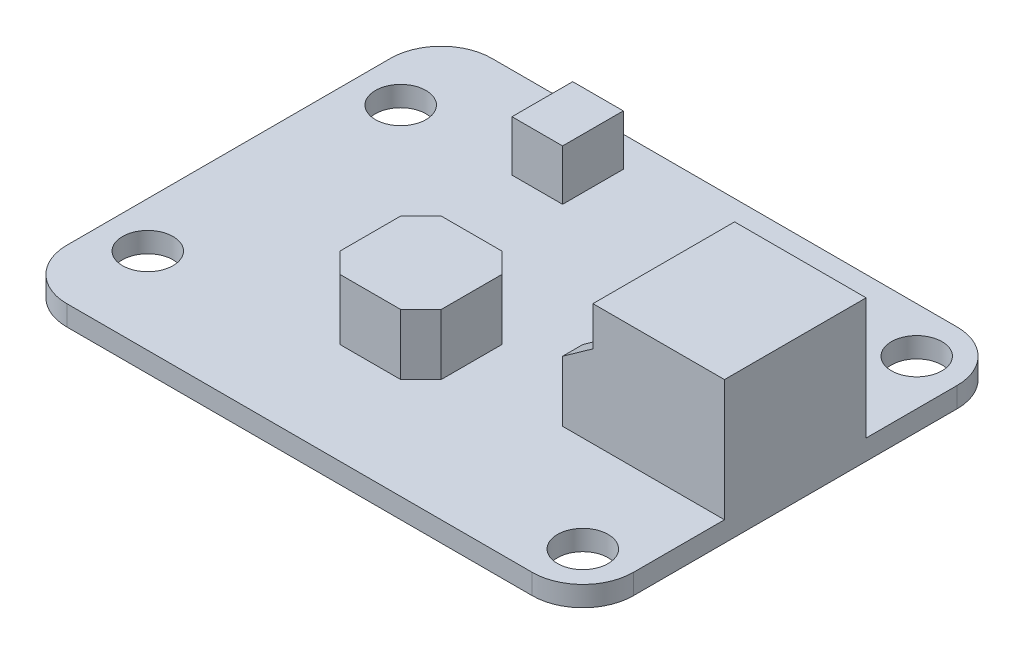
from build123d import *

# Parameters (mm, degrees)
CROQUIS1_R              = 1.25
SALIENTE_EXTRUIR1_DEPTH = 1
SALIENTE_EXTRUIR2_DEPTH = 6
CORTAR_EXTRUIR1_DEPTH   = 22
SALIENTE_EXTRUIR3_DEPTH = 3
CROQUIS5_W              = 2.5
CROQUIS5_H              = 3
SALIENTE_EXTRUIR4_DEPTH = 2.5


with BuildPart() as part:
    # Croquis1 → Saliente-Extruir1 (new body)
    with BuildSketch(Plane(origin=(0, 0, 0), x_dir=(1, 0, 0), z_dir=(0, 1, 0))):
        with BuildLine():
            Line((-11.5, -10.5), (11.5, -10.5))
            ThreePointArc((11.5, -10.5), (13.267766953, -9.767766953), (14, -8))
            Line((14, -8), (14, 8))
            ThreePointArc((14, 8), (13.267766953, 9.767766953), (11.5, 10.5))
            Line((11.5, 10.5), (-11.5, 10.5))
            ThreePointArc((-11.5, 10.5), (-13.267766953, 9.767766953), (-14, 8))
            Line((-14, 8), (-14, -8))
            ThreePointArc((-14, -8), (-13.267766953, -9.767766953), (-11.5, -10.5))
        make_face()
        with Locations(Location((11.75, -8.25, 0), (0, 0, 270))):
            Circle(CROQUIS1_R, mode=Mode.SUBTRACT)
        with Locations(Location((11.75, 8.25, 0), (0, 0, 270))):
            Circle(CROQUIS1_R, mode=Mode.SUBTRACT)
        with Locations(Location((-11.75, 6.25, 0), (0, 0, 270))):
            Circle(CROQUIS1_R, mode=Mode.SUBTRACT)
        with Locations(Location((-11.75, -6.25, 0), (0, 0, 270))):
            Circle(CROQUIS1_R, mode=Mode.SUBTRACT)
    extrude(amount=SALIENTE_EXTRUIR1_DEPTH)

    # Croquis2 → Saliente-Extruir2 (add)
    with BuildSketch(Plane(origin=(0, 1, 0), x_dir=(1, 0, 0), z_dir=(0, 1, 0))):
        Polygon((14, -3.5), (6, -3.5), (6, -2.5), (7.5, -2.5), (7.5, 2.5), (6, 2.5), (6, 3.5), (14, 3.5), align=None)
    extrude(amount=SALIENTE_EXTRUIR2_DEPTH)

    # Croquis3 → Cortar-Extruir1 (cut, through all)
    with BuildSketch(Plane.XY.offset(3.5)):
        Polygon((7.5, 7), (7.5, 5.064017175), (6, 4), (6, 7), align=None)
    extrude(amount=-CORTAR_EXTRUIR1_DEPTH, mode=Mode.SUBTRACT)

    # Croquis4 → Saliente-Extruir3 (add)
    with BuildSketch(Plane(origin=(0, 1, 0), x_dir=(1, 0, 0), z_dir=(0, 1, 0))):
        Polygon((-3, -5.5), (0, -5.5), (1, -4.5), (1, -1.5), (0, -0.5), (-3, -0.5), (-4, -1.5), (-4, -4.5), align=None)
    extrude(amount=SALIENTE_EXTRUIR3_DEPTH)

    # Croquis5 → Saliente-Extruir4 (add)
    with BuildSketch(Plane(origin=(0, 1, 0), x_dir=(1, 0, 0), z_dir=(0, 1, 0))):
        with Locations((-4.75, 7.5)):
            Rectangle(CROQUIS5_W, CROQUIS5_H)
    extrude(amount=SALIENTE_EXTRUIR4_DEPTH)


solid = part.part
